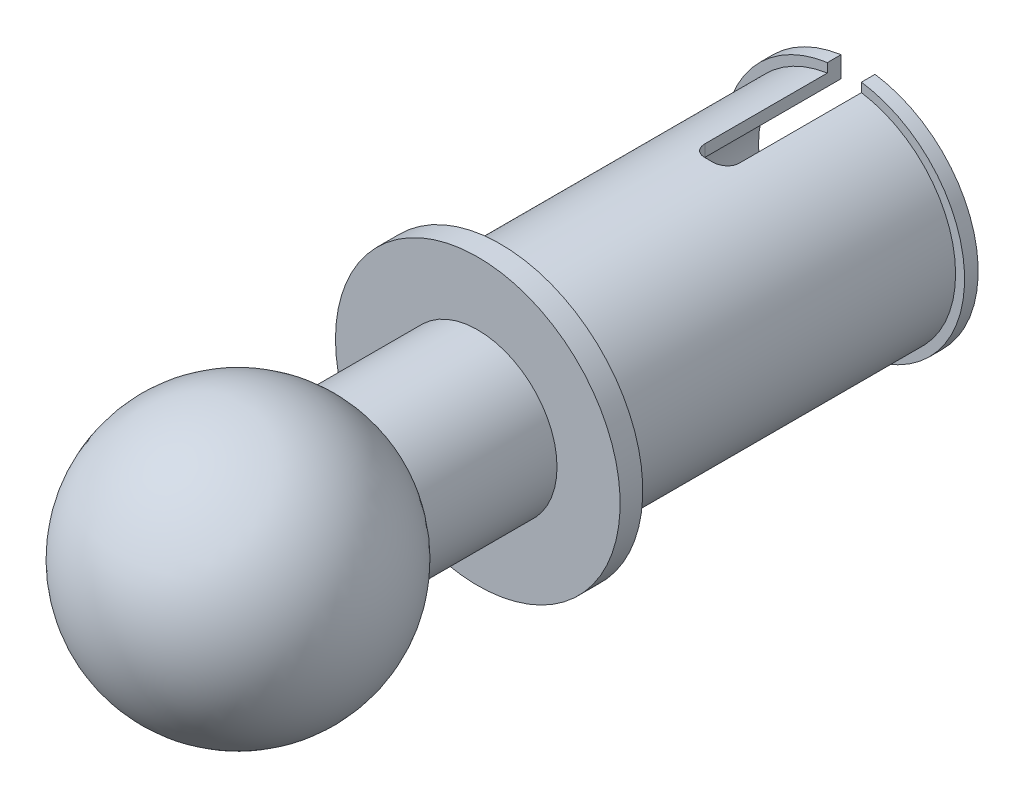
from build123d import *

# Parameters (mm, degrees)
BOSS_EXTRUDE1_DEPTH = 7.9
SKETCH2_R           = 3.144549921
BOSS_EXTRUDE3_DEPTH = 0.5
SKETCH3_R           = 2.455888386
BOSS_EXTRUDE4_DEPTH = 7.9
SKETCH4_R           = 2.65462565
BOSS_EXTRUDE5_DEPTH = 0.3
SKETCH5_R           = 2.198604039
CUT_EXTRUDE1_DEPTH  = 7.9
CUT_EXTRUDE2_DEPTH  = 3.3
FILLET1_R           = 0.3
CUT_EXTRUDE5_START  = 9
SKETCH7_R           = 3.144549921
CUT_EXTRUDE5_DEPTH  = 9
SKETCH8_R           = 1.75
BOSS_EXTRUDE6_DEPTH = 3


with BuildPart() as part:
    # Sketch1 → Boss-Extrude1 (new body)
    with BuildSketch(Plane.XY):
        Polygon((-2.4, 0.895), (-2.4, 0), (0, 0), (0, 2.4), (-0.9, 2.4), (-0.9, 0.895), align=None)
        Polygon((0, 0), (-2.4, 0), (-2.4, -0.895), (-0.9, -0.895), (-0.9, -2.4), (0, -2.4), align=None)
        Polygon((0, 2.4), (0, 0), (2.4, 0), (2.4, 0.895), (0.9, 0.895), (0.9, 2.4), align=None)
        Polygon((2.4, 0), (0, 0), (0, -2.4), (0.9, -2.4), (0.9, -0.895), (2.4, -0.895), align=None)
    extrude(amount=BOSS_EXTRUDE1_DEPTH)

    # Sketch2 → Boss-Extrude3 (add)
    with BuildSketch(Plane(origin=(0, 0, 0), x_dir=(-1, 0, 0), z_dir=(0, 0, -1))):
        Circle(SKETCH2_R)
    extrude(amount=BOSS_EXTRUDE3_DEPTH)

    # Sketch3 → Boss-Extrude4 (add)
    with BuildSketch(Plane(origin=(0, 0, -0.5), x_dir=(-1, 0, 0), z_dir=(0, 0, -1))):
        Circle(SKETCH3_R)
    extrude(amount=BOSS_EXTRUDE4_DEPTH)

    # Sketch4 → Boss-Extrude5 (add)
    with BuildSketch(Plane(origin=(0, 0, -8.4), x_dir=(-1, 0, 0), z_dir=(0, 0, -1))):
        Circle(SKETCH4_R)
    extrude(amount=-BOSS_EXTRUDE5_DEPTH)

    # Sketch5 → Cut-Extrude1 (cut)
    with BuildSketch(Plane(origin=(0, 0, -8.4), x_dir=(-1, 0, 0), z_dir=(0, 0, -1))):
        Circle(SKETCH5_R)
    extrude(amount=-CUT_EXTRUDE1_DEPTH, mode=Mode.SUBTRACT)

    # Sketch6 → Cut-Extrude2 (cut)
    with BuildSketch(Plane(origin=(0, 0, -8.4), x_dir=(-1, 0, 0), z_dir=(0, 0, -1))):
        with BuildLine():
            Line((0.375484044, 2.166303638), (0.375484044, 2.627936276))
            ThreePointArc((0.375484044, 2.627936276), (0.188215694, 2.6479449), (0, 2.65462565))
            Line((0, 2.65462565), (0, 2.198604039))
            ThreePointArc((0, 2.198604039), (0.188435389, 2.190514055), (0.375484044, 2.166303638))
        make_face()
        with BuildLine():
            Line((0, 2.198604039), (0, 2.65462565))
            ThreePointArc((0, 2.65462565), (-0.188215694, 2.6479449), (-0.375484044, 2.627936276))
            Line((-0.375484044, 2.627936276), (-0.375484044, 2.166303638))
            ThreePointArc((-0.375484044, 2.166303638), (-0.188435389, 2.190514055), (0, 2.198604039))
        make_face()
        with BuildLine():
            ThreePointArc((0, -2.65462565), (0.188215694, -2.6479449), (0.375484044, -2.627936276))
            Line((0.375484044, -2.627936276), (0.375484044, -2.166303638))
            ThreePointArc((0.375484044, -2.166303638), (0, -2.198604039), (-0.375484044, -2.166303638))
            Line((-0.375484044, -2.166303638), (-0.375484044, -2.627936276))
            ThreePointArc((-0.375484044, -2.627936276), (-0.188215694, -2.6479449), (0, -2.65462565))
        make_face()
    extrude(amount=-CUT_EXTRUDE2_DEPTH, mode=Mode.SUBTRACT)

    # Fillet1
    fillet1_edges = [part.edges().sort_by_distance(p)[0] for p in [
        (0.375484044, 2.296659081, -5.1),
        (-0.375484044, 2.296659081, -5.1),
        (-0.375484044, -2.296659081, -5.1),
        (0.375484044, -2.296659081, -5.1),
    ]]
    fillet(fillet1_edges, radius=FILLET1_R)

    # Sketch7 → Cut-Extrude5 (cut)
    with BuildSketch(Plane.XY.offset(CUT_EXTRUDE5_START)):
        with Locations(Location((0, 0, 0), (0, 0, 180))):
            Circle(SKETCH7_R)
    extrude(amount=-CUT_EXTRUDE5_DEPTH, mode=Mode.SUBTRACT)

    # Sketch8 → Boss-Extrude6 (add)
    with BuildSketch(Plane.XY):
        Circle(SKETCH8_R)
    extrude(amount=BOSS_EXTRUDE6_DEPTH)

    # Sketch9 → Revolve1 (revolve)
    with BuildSketch(Plane(origin=(0, 0, 0), x_dir=(0, 0, -1), z_dir=(1, 0, 0))):
        with BuildLine():
            Line((-5.297920188, 3.009117544), (-5.297920188, -2.990882456))
            ThreePointArc((-5.297920188, -2.990882456), (-2.297920188, 0.009117544), (-5.297920188, 3.009117544))
        make_face()
    revolve(axis=Axis((0, 3.009117544, 5.297920188), (0, -1, 0)))


solid = part.part
